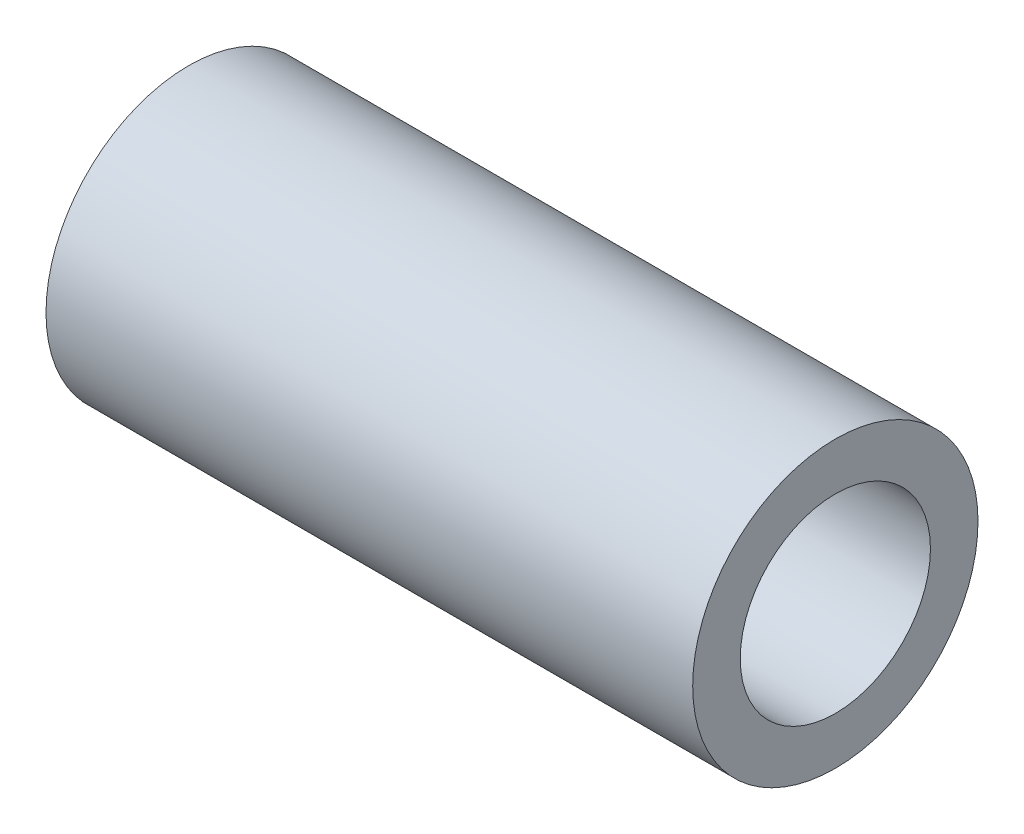
from build123d import *

# Parameters (mm, degrees)
SKETCH1_W = 20.4
SKETCH1_H = 4.5
SKETCH2_W = 20.4
SKETCH2_H = 3


with BuildPart() as part:
    # Sketch1 → Revolve1 (revolve)
    with BuildSketch(Plane.XY, mode=Mode.PRIVATE) as revolve1_sk:
        with Locations((10.2, 2.25)):
            Rectangle(SKETCH1_W, SKETCH1_H)
    revolve(revolve1_sk.sketch.rotate(Axis((-6.500834374, 0, 0), (1, 0, 0)), 90), axis=Axis((-6.500834374, 0, 0), (1, 0, 0)))

    # Sketch2 → Cut-Revolve1 (revolve, cut)
    with BuildSketch(Plane.XY, mode=Mode.PRIVATE) as cut_revolve1_sk:
        with Locations((10.2, 1.5)):
            Rectangle(SKETCH2_W, SKETCH2_H)
    revolve(cut_revolve1_sk.sketch.rotate(Axis((-3.053927559, 0, 0), (1, 0, 0)), 90), axis=Axis((-3.053927559, 0, 0), (1, 0, 0)), mode=Mode.SUBTRACT)


solid = part.part
